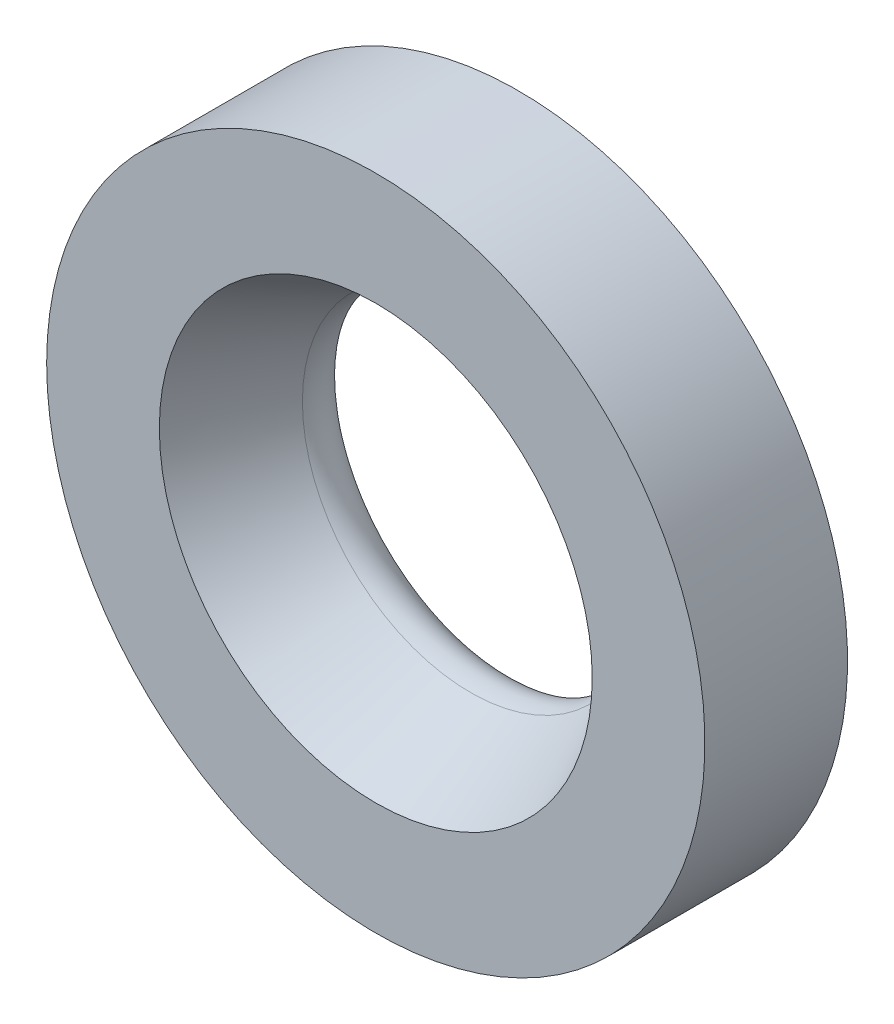
from build123d import *


with BuildPart() as part:
    # Sketch2 → Revolve1 (revolve)
    with BuildSketch(Plane.YZ, mode=Mode.PRIVATE) as revolve1_sk:
        with BuildLine():
            Line((-15, 0), (-9.864137891, 0))
            Line((-9.864137891, 0), (-7.663490214, -4.31901425))
            ThreePointArc((-7.663490214, -4.31901425), (-9.463525492, -6.426584774), (-9.68098575, -3.663490214))
            Line((-9.68098575, -3.663490214), (-10.783339073, -1.5))
            Line((-10.783339073, -1.5), (-13.5, -1.5))
            Line((-13.5, -1.5), (-13.5, -6.5))
            Line((-13.5, -6.5), (-15, -6.5))
            Line((-15, -6.5), (-15, 0))
        make_face()
    revolve(revolve1_sk.sketch.rotate(Axis((0, 0, 0), (0, 0, 1)), 270), axis=Axis((0, 0, 0), (0, 0, 1)))


solid = part.part
